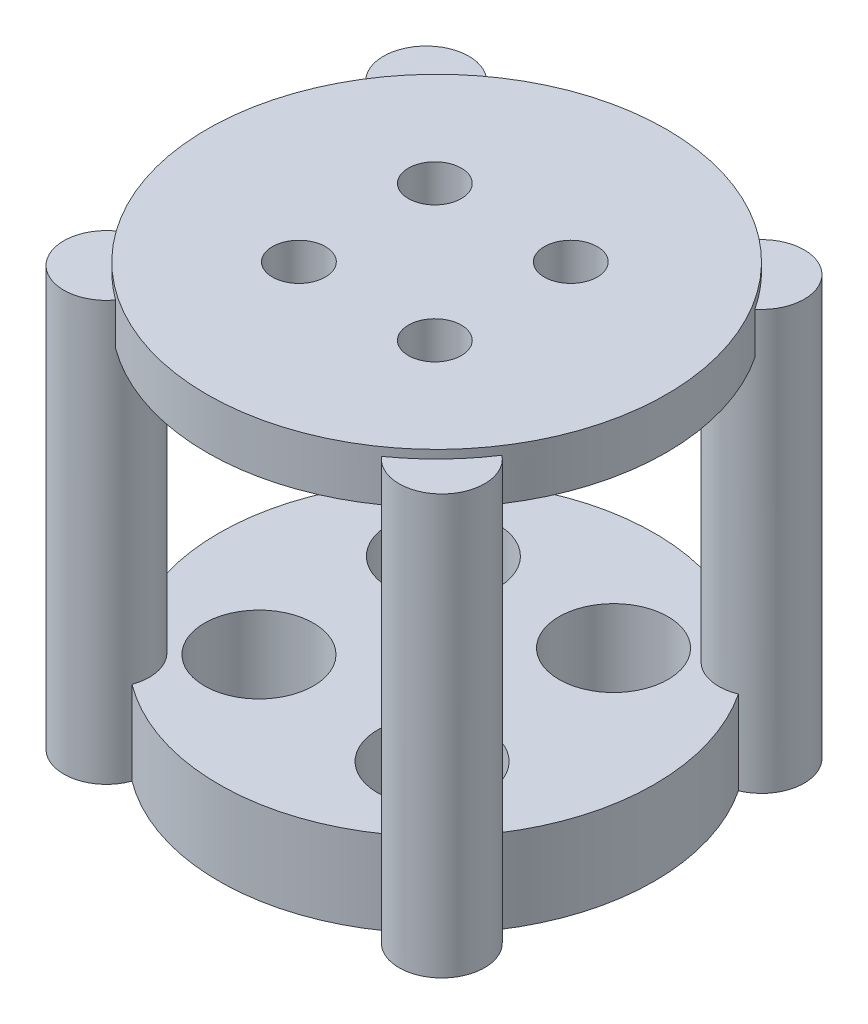
from build123d import *

# Parameters (mm, degrees)
SKETCH1_R                = 25.969085179
BOSS_EXTRUDE1_DEPTH      = 10
CUT_EXTRUDE6_DEPTH       = 10
CUT_EXTRUDE6_DEPTH_BACK  = 10
SKETCH2_R                = 6.5
SKETCH4_R                = 5.101859566
BOSS_EXTRUDE2_DEPTH      = 50
BOSS_EXTRUDE3_DEPTH      = 1
BOSS_EXTRUDE3_DEPTH_BACK = 5
SKETCH5_R                = 27.403110043
SKETCH6_R                = 3.156893789
CUT_EXTRUDE7_DEPTH       = 6
CIRPATTERN1_COUNT        = 4


with BuildPart() as part:
    # Sketch1 → Boss-Extrude1 (new body)
    with BuildSketch(Plane(origin=(0, 0, 0), x_dir=(1, 0, 0), z_dir=(0, 1, 0))):
        with Locations(Location((0, 0, 0), (0, 0, 270))):
            Circle(SKETCH1_R)
    extrude(amount=BOSS_EXTRUDE1_DEPTH)

    # Sketch2 → Cut-Extrude6 (cut, two sides: drawn at the far end of the back side and taken through both)
    with BuildSketch(Plane(origin=(0, 0, 0), x_dir=(1, 0, 0), z_dir=(0, 1, 0)).offset(-CUT_EXTRUDE6_DEPTH_BACK)):
        with Locations(Location((-10.19719706, 11.000780524, 0), (0, 0, 270))):
            Circle(SKETCH2_R)
        with Locations(Location((-11.032390275, -10.162989955, 0), (0, 0, 270))):
            Circle(SKETCH2_R)
        with Locations(Location((10.330398744, -10.875792467, 0), (0, 0, 270))):
            Circle(SKETCH2_R)
        with Locations(Location((9.448943305, 11.649784136, 0), (0, 0, 270))):
            Circle(SKETCH2_R)
    extrude(amount=CUT_EXTRUDE6_DEPTH + CUT_EXTRUDE6_DEPTH_BACK, mode=Mode.SUBTRACT)

    # Sketch4 → Boss-Extrude2 (add)
    with BuildSketch(Plane(origin=(0, 0, 0), x_dir=(1, 0, 0), z_dir=(0, 1, 0))):
        with Locations(Location((-20.316325534, 19.065240611, 0), (0, 0, 20.088676174))):
            Circle(SKETCH4_R)
        with Locations(Location((19.683674466, 19.065240611, 0), (0, 0, 155.604859665))):
            Circle(SKETCH4_R)
    boss_extrude2 = extrude(amount=BOSS_EXTRUDE2_DEPTH)

    # Mirror1: Boss-Extrude2 across plane
    add(boss_extrude2.mirror(Plane.XY))

    # Sketch5 → Boss-Extrude3 (add, two sides: drawn at the far end of the back side and taken through both)
    with BuildSketch(Plane(origin=(0, 50, 0), x_dir=(1, 0, 0), z_dir=(0, 1, 0)).offset(-BOSS_EXTRUDE3_DEPTH_BACK)):
        with Locations(Location((0, 0, 0), (0, 0, 270))):
            Circle(SKETCH5_R)
    extrude(amount=BOSS_EXTRUDE3_DEPTH + BOSS_EXTRUDE3_DEPTH_BACK)

    # Sketch6 → Cut-Extrude7 (cut)
    with BuildSketch(Plane(origin=(0, 51, 0), x_dir=(1, 0, 0), z_dir=(0, 1, 0))):
        with Locations(Location((8, 8, 0), (0, 0, 270))):
            Circle(SKETCH6_R)
    cut_extrude7 = extrude(amount=-CUT_EXTRUDE7_DEPTH, mode=Mode.SUBTRACT)

    # CirPattern1: Cut-Extrude7 ×4 about axis
    cirpattern1_axis = Axis((-0.107600069, 0, 0.107600069), (0, 1, 0))
    for i in range(1, CIRPATTERN1_COUNT):
        add(cut_extrude7.rotate(cirpattern1_axis, i * 360 / CIRPATTERN1_COUNT), mode=Mode.SUBTRACT)


solid = part.part
